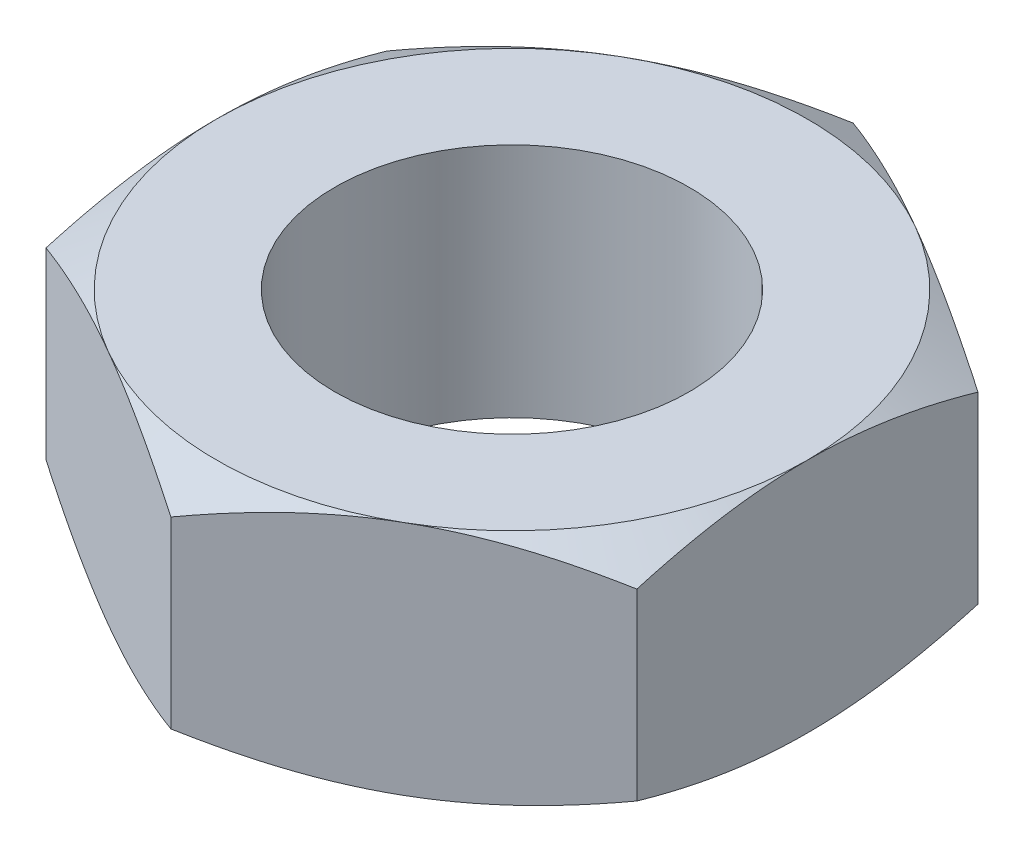
from build123d import *

# Parameters (mm, degrees)
SKETCH1_R               = 1.5
BOSS_EXTRUDE1_DEPTH     = 2
SKETCH2_OUTSIDE_W       = 15.508
SKETCH2_OUTSIDE_H       = 16.282
SKETCH2_OUTSIDE_R       = 2.5
CUT_EXTRUDE1_DEPTH      = 2
CUT_EXTRUDE1_DRAFT      = -60
MIRROR1_COPY_1_SKETCH_W = 15.508
MIRROR1_COPY_1_SKETCH_H = 16.282
MIRROR1_COPY_1_SKETCH_R = 2.5
MIRROR1_COPY_1_DEPTH    = 2
MIRROR1_COPY_1_DRAFT    = -60


with BuildPart() as part:
    # Sketch1 → Boss-Extrude1 (new body)
    with BuildSketch(Plane(origin=(0, 0, 0), x_dir=(1, 0, 0), z_dir=(0, 1, 0))):
        Polygon((0, 2.886751346), (-2.5, 1.443375673), (-2.5, -1.443375673), (0, -2.886751346), (2.5, -1.443375673), (2.5, 1.443375673), align=None)
        with Locations(Location((0, 0, 0), (0, 0, 270))):
            Circle(SKETCH1_R, mode=Mode.SUBTRACT)
    extrude(amount=BOSS_EXTRUDE1_DEPTH)


with BuildPart() as cut_extrude1_tool:
    # Sketch2 outside → Cut-Extrude1 (with draft: the straight prism first)
    with BuildSketch(Plane(origin=(0, 2, 0), x_dir=(1, 0, 0), z_dir=(0, 1, 0))):
        Rectangle(SKETCH2_OUTSIDE_W, SKETCH2_OUTSIDE_H)
        Circle(SKETCH2_OUTSIDE_R, mode=Mode.SUBTRACT)
    extrude(amount=-CUT_EXTRUDE1_DEPTH)
    # Cut-Extrude1: the draft: its side faces are tilted about the plane it starts from
    cut_extrude1_sides = [cut_extrude1_tool.faces().sort_by_distance(p)[0] for p in [
        (0, 1, 8.141),
        (7.754, 1, 0),
        (0, 1, -8.141),
        (-7.754, 1, 0),
        (-2.5, 1, 0),
    ]]
    draft(cut_extrude1_sides, Plane(origin=(0, 2, 0), x_dir=(1, 0, 0), z_dir=(0, 1, 0)), CUT_EXTRUDE1_DRAFT)


with BuildPart() as part_1:
    add(part.part)

    # Cut-Extrude1: cut by cut_extrude1_tool
    add(cut_extrude1_tool.part, mode=Mode.SUBTRACT)


with BuildPart() as mirror1_copy_1_tool:
    # Mirror1 copy 1 sketch → Mirror1 copy 1 (with draft: the straight prism first)
    with BuildSketch(Plane.XZ):
        Rectangle(MIRROR1_COPY_1_SKETCH_W, MIRROR1_COPY_1_SKETCH_H)
        Circle(MIRROR1_COPY_1_SKETCH_R, mode=Mode.SUBTRACT)
    extrude(amount=-MIRROR1_COPY_1_DEPTH)
    # Mirror1 copy 1: the draft: its side faces are tilted about the plane it starts from
    mirror1_copy_1_sides = [mirror1_copy_1_tool.faces().sort_by_distance(p)[0] for p in [
        (0, 1, 8.141),
        (7.754, 1, 0),
        (0, 1, -8.141),
        (-7.754, 1, 0),
        (-2.5, 1, 0),
    ]]
    draft(mirror1_copy_1_sides, Plane.XZ, MIRROR1_COPY_1_DRAFT)


with BuildPart() as part_2:
    add(part_1.part)

    # Mirror1 copy 1: cut by mirror1_copy_1_tool
    add(mirror1_copy_1_tool.part, mode=Mode.SUBTRACT)


solid = part_2.part
